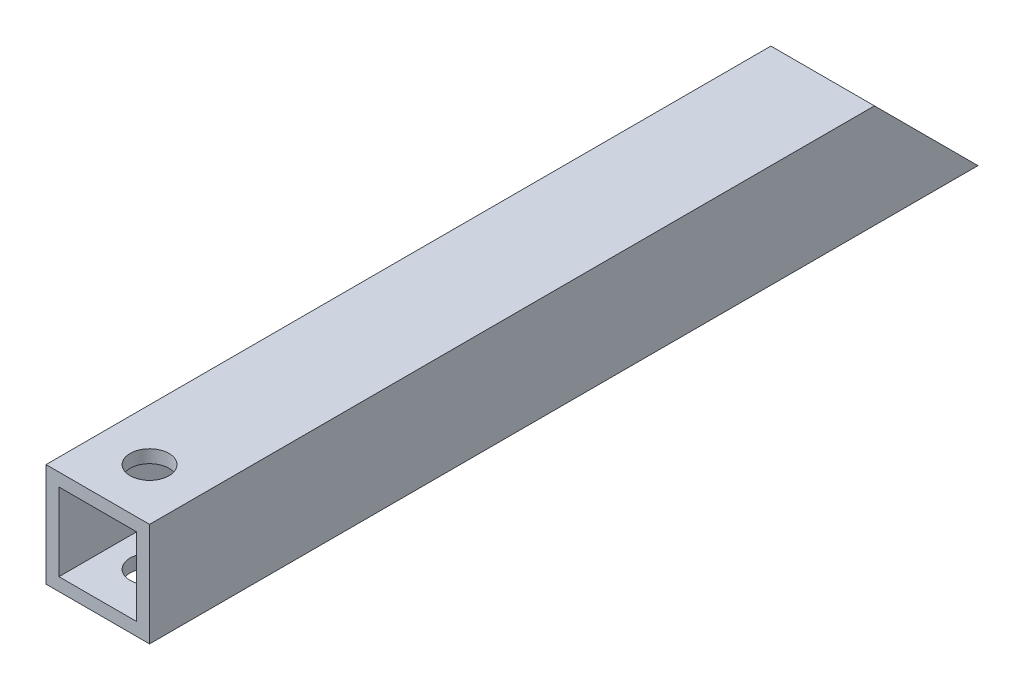
from build123d import *

# Parameters (mm, degrees)
SKETCH1_W                    = 25.4
SKETCH1_H                    = 25.4
SKETCH1_W_2                  = 19.05
SKETCH1_H_2                  = 19.05
BOSS_EXTRUDE1_DEPTH          = 203.2
CUT_EXTRUDE1_DEPTH           = 206.174779152
F_3_8_0_375_DIAMETER_HOLE1_D = 9.525


with BuildPart() as part:
    # Sketch1 → Boss-Extrude1 (new body)
    with BuildSketch(Plane.XY):
        Rectangle(SKETCH1_W, SKETCH1_H)
        Rectangle(SKETCH1_W_2, SKETCH1_H_2, mode=Mode.SUBTRACT)
    extrude(amount=BOSS_EXTRUDE1_DEPTH)

    # Sketch2 → Cut-Extrude1 (cut, through all)
    with BuildSketch(Plane(origin=(12.7, 0, 0), x_dir=(0, 0, -1), z_dir=(1, 0, 0))):
        Polygon((0, 12.7), (0, -12.7), (-25.4, 12.7), align=None)
    extrude(amount=-CUT_EXTRUDE1_DEPTH, mode=Mode.SUBTRACT)

    # 3/8 (0.375) Diameter Hole1 (through all)
    with Locations(Plane(origin=(0, -12.7, 0), x_dir=(-1, 0, 0), z_dir=(0, -1, 0))):
        with Locations((0, -190.5)):
            Hole(F_3_8_0_375_DIAMETER_HOLE1_D / 2)


solid = part.part
